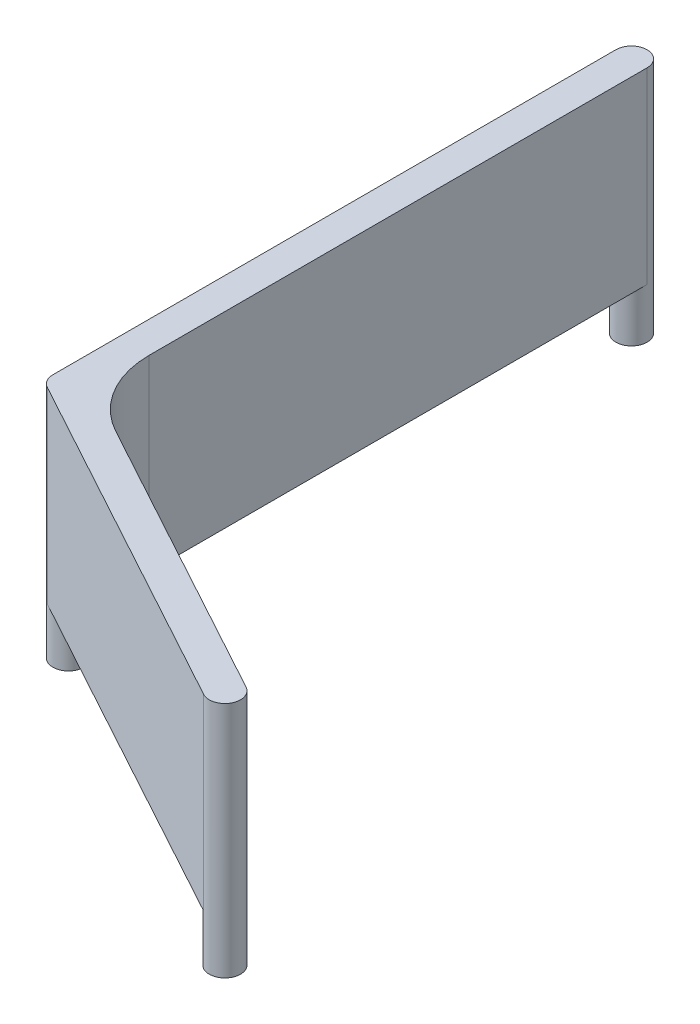
from build123d import *

# Parameters (mm, degrees)
BOSS_EXTRUDE1_DEPTH = 38.1
BOSS_EXTRUDE2_START = 10.16
SKETCH2_R           = 3.175
BOSS_EXTRUDE2_DEPTH = 10.16
FILLET1_R           = 19.05


with BuildPart() as part:
    # Sketch1 → Boss-Extrude1 (new body)
    with BuildSketch(Plane(origin=(0, 0, 0), x_dir=(1, 0, 0), z_dir=(0, 1, 0))):
        with BuildLine():
            Line((-3.175, 0), (-3.175, 114.3))
            ThreePointArc((-3.175, 114.3), (0, 117.475), (3.175, 114.3))
            Line((3.175, 114.3), (3.175, 1.884785088))
            Line((3.175, 1.884785088), (71.370355515, -35.312681556))
            ThreePointArc((71.370355515, -35.312681556), (72.637318444, -39.620355515), (68.329644485, -40.887318444))
            Line((68.329644485, -40.887318444), (-1.520355515, -2.787318444))
            ThreePointArc((-1.520355515, -2.787318444), (-2.73017891, -1.620724566), (-3.175, 0))
        make_face()
    extrude(amount=BOSS_EXTRUDE1_DEPTH)

    # Sketch2 → Boss-Extrude2 (add)
    with BuildSketch(Plane(origin=(0, 0, 0), x_dir=(-1, 0, 0), z_dir=(0, -1, 0)).offset(BOSS_EXTRUDE2_START)):
        with Locations(Location((0, 114.3, 0), (0, 0, 90))):
            Circle(SKETCH2_R)
        with Locations(Location((0, 0, 0), (0, 0, 90))):
            Circle(SKETCH2_R)
        with Locations(Location((-69.85, -38.1, 0), (0, 0, 90))):
            Circle(SKETCH2_R)
    extrude(amount=-BOSS_EXTRUDE2_DEPTH)

    # Fillet1
    fillet1_edges = [part.edges().sort_by_distance(p)[0] for p in [
        (3.175, 19.05, -1.884785088),
    ]]
    fillet(fillet1_edges, radius=FILLET1_R)


solid = part.part
